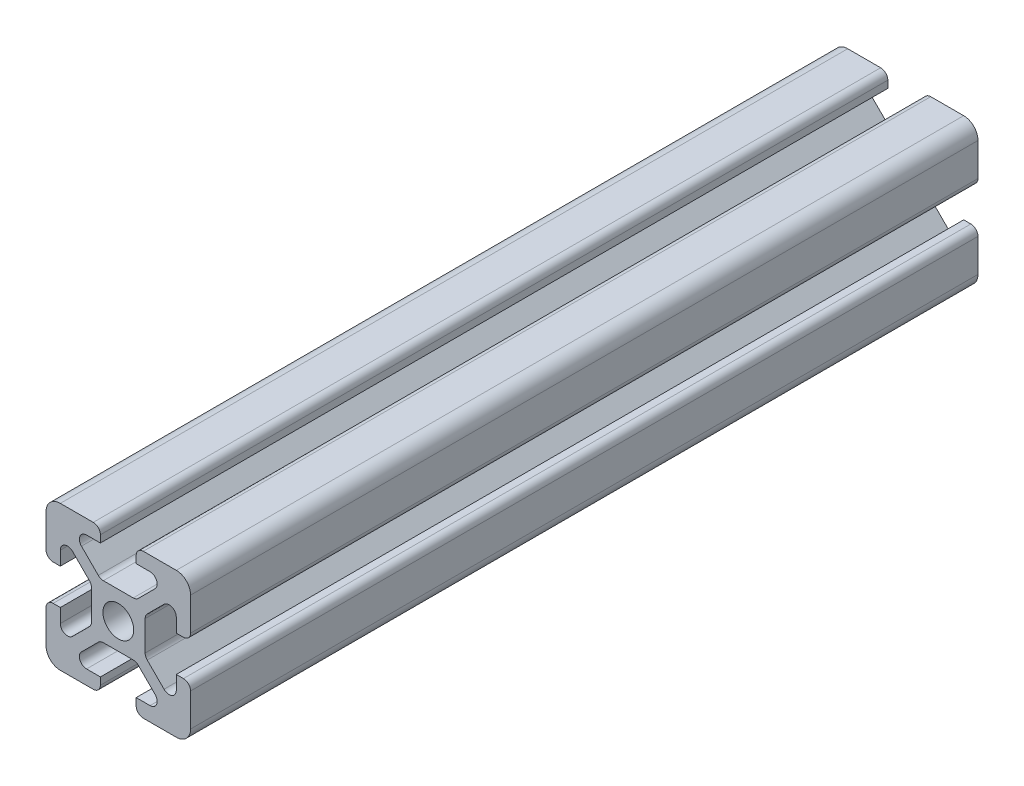
from build123d import *

# Parameters (mm, degrees)
SKETCH1_R           = 2.15
BOSS_EXTRUDE1_DEPTH = 110


with BuildPart() as part:
    # Sketch1 → Boss-Extrude1 (new body)
    with BuildSketch(Plane.XY):
        with BuildLine():
            Line((2, 0), (6.6, 0))
            ThreePointArc((6.6, 0), (7.307106781, 0.292893219), (7.6, 1))
            Line((7.6, 1), (7.6, 2))
            Line((7.6, 2), (5.664213562, 2))
            ThreePointArc((5.664213562, 2), (4.74033403, 2.617316568), (4.957106781, 3.707106781))
            Line((4.957106781, 3.707106781), (7.307106781, 6.057106781))
            ThreePointArc((7.307106781, 6.057106781), (7.63153013, 6.273879533), (8.014213562, 6.35))
            Line((8.014213562, 6.35), (12.185786438, 6.35))
            ThreePointArc((12.185786438, 6.35), (12.56846987, 6.273879533), (12.892893219, 6.057106781))
            Line((12.892893219, 6.057106781), (15.242893219, 3.707106781))
            ThreePointArc((15.242893219, 3.707106781), (15.45966597, 2.617316568), (14.535786438, 2))
            Line((14.535786438, 2), (12.6, 2))
            Line((12.6, 2), (12.6, 1))
            ThreePointArc((12.6, 1), (12.892893219, 0.292893219), (13.6, 0))
            Line((13.6, 0), (18.2, 0))
            ThreePointArc((18.2, 0), (19.614213562, 0.585786438), (20.2, 2))
            Line((20.2, 2), (20.2, 6.6))
            ThreePointArc((20.2, 6.6), (19.907106781, 7.307106781), (19.2, 7.6))
            Line((19.2, 7.6), (18.2, 7.6))
            Line((18.2, 7.6), (18.2, 5.664213562))
            ThreePointArc((18.2, 5.664213562), (17.582683432, 4.74033403), (16.492893219, 4.957106781))
            Line((16.492893219, 4.957106781), (14.142893219, 7.307106781))
            ThreePointArc((14.142893219, 7.307106781), (13.926120467, 7.63153013), (13.85, 8.014213562))
            Line((13.85, 8.014213562), (13.85, 12.185786438))
            ThreePointArc((13.85, 12.185786438), (13.926120467, 12.56846987), (14.142893219, 12.892893219))
            Line((14.142893219, 12.892893219), (16.492893219, 15.242893219))
            ThreePointArc((16.492893219, 15.242893219), (17.582683432, 15.45966597), (18.2, 14.535786438))
            Line((18.2, 14.535786438), (18.2, 12.6))
            Line((18.2, 12.6), (19.2, 12.6))
            ThreePointArc((19.2, 12.6), (19.907106781, 12.892893219), (20.2, 13.6))
            Line((20.2, 13.6), (20.2, 18.2))
            ThreePointArc((20.2, 18.2), (19.614213562, 19.614213562), (18.2, 20.2))
            Line((18.2, 20.2), (13.6, 20.2))
            ThreePointArc((13.6, 20.2), (12.892893219, 19.907106781), (12.6, 19.2))
            Line((12.6, 19.2), (12.6, 18.2))
            Line((12.6, 18.2), (14.535786438, 18.2))
            ThreePointArc((14.535786438, 18.2), (15.45966597, 17.582683432), (15.242893219, 16.492893219))
            Line((15.242893219, 16.492893219), (12.892893219, 14.142893219))
            ThreePointArc((12.892893219, 14.142893219), (12.56846987, 13.926120467), (12.185786438, 13.85))
            Line((12.185786438, 13.85), (8.014213562, 13.85))
            ThreePointArc((8.014213562, 13.85), (7.63153013, 13.926120467), (7.307106781, 14.142893219))
            Line((7.307106781, 14.142893219), (4.957106781, 16.492893219))
            ThreePointArc((4.957106781, 16.492893219), (4.74033403, 17.582683432), (5.664213562, 18.2))
            Line((5.664213562, 18.2), (7.6, 18.2))
            Line((7.6, 18.2), (7.6, 19.2))
            ThreePointArc((7.6, 19.2), (7.307106781, 19.907106781), (6.6, 20.2))
            Line((6.6, 20.2), (2, 20.2))
            ThreePointArc((2, 20.2), (0.585786438, 19.614213562), (0, 18.2))
            Line((0, 18.2), (0, 13.6))
            ThreePointArc((0, 13.6), (0.292893219, 12.892893219), (1, 12.6))
            Line((1, 12.6), (2, 12.6))
            Line((2, 12.6), (2, 14.535786438))
            ThreePointArc((2, 14.535786438), (2.617316568, 15.45966597), (3.707106781, 15.242893219))
            Line((3.707106781, 15.242893219), (6.057106781, 12.892893219))
            ThreePointArc((6.057106781, 12.892893219), (6.273879533, 12.56846987), (6.35, 12.185786438))
            Line((6.35, 12.185786438), (6.35, 8.014213562))
            ThreePointArc((6.35, 8.014213562), (6.273879533, 7.63153013), (6.057106781, 7.307106781))
            Line((6.057106781, 7.307106781), (3.707106781, 4.957106781))
            ThreePointArc((3.707106781, 4.957106781), (2.617316568, 4.74033403), (2, 5.664213562))
            Line((2, 5.664213562), (2, 7.6))
            Line((2, 7.6), (1, 7.6))
            ThreePointArc((1, 7.6), (0.292893219, 7.307106781), (0, 6.6))
            Line((0, 6.6), (0, 2))
            ThreePointArc((0, 2), (0.585786438, 0.585786438), (2, 0))
        make_face()
        with Locations((10.1, 10)):
            Circle(SKETCH1_R, mode=Mode.SUBTRACT)
    extrude(amount=BOSS_EXTRUDE1_DEPTH)


solid = part.part
